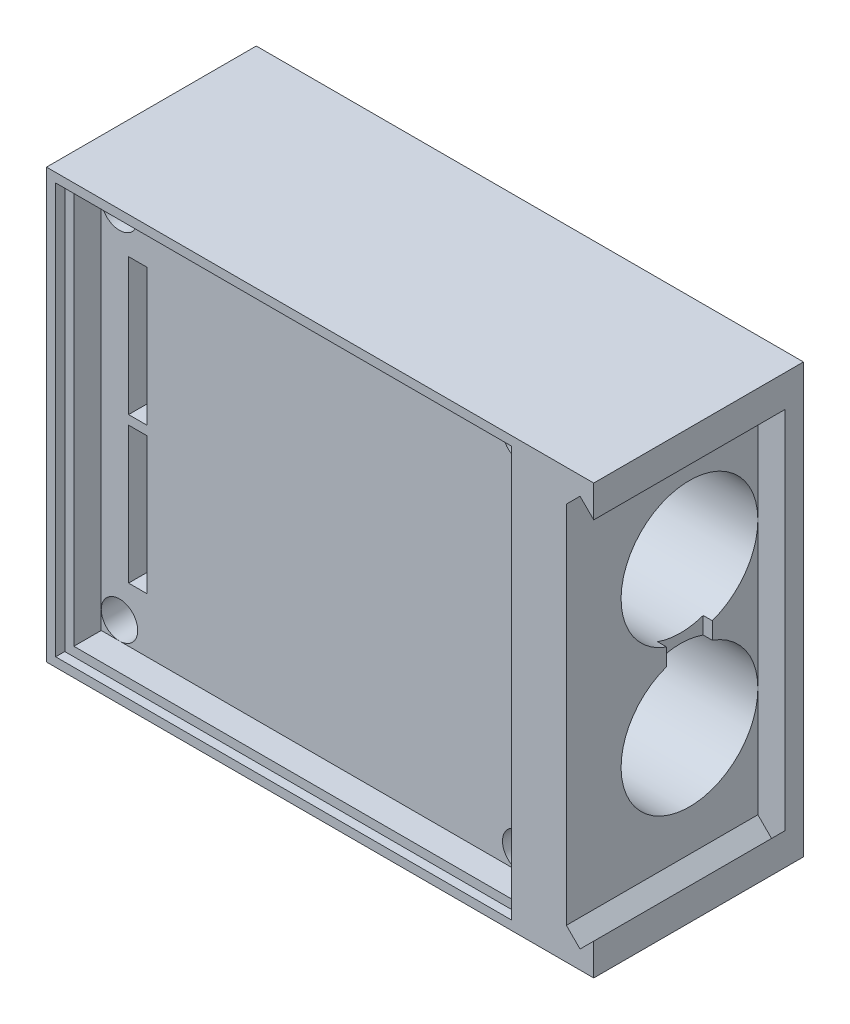
from build123d import *
from OCP.BRepFilletAPI import BRepFilletAPI_MakeChamfer

# Parameters (mm, degrees)
ESQUISSE1_W             = 60
ESQUISSE1_H             = 47
BOSS_EXTRU_1_DEPTH      = 23
ESQUISSE2_W             = 50
ESQUISSE2_H             = 45
ENL_V_MAT_EXTRU_1_DEPTH = 1
ESQUISSE3_W             = 48
ESQUISSE3_H             = 43
ENL_V_MAT_EXTRU_2_DEPTH = 3
ENL_V_MAT_EXTRU_3_DEPTH = 21
ESQUISSE5_R             = 7.5
ENL_V_MAT_EXTRU_4_DEPTH = 51
ESQUISSE8_W             = 2
ESQUISSE8_H             = 15
ENL_V_MAT_EXTRU_5_DEPTH = 17
ESQUISSE9_R             = 2
ENL_V_MAT_EXTRU_6_DEPTH = 80.61155695
CHANFREIN1_SIZE         = 1
CHANFREIN1_SIZE2        = 1.428148007
ESQUISSE10_W            = 5
ESQUISSE10_H            = 10
ENL_V_MAT_EXTRU_7_DEPTH = 1


with BuildPart() as part:
    # Esquisse1 → Boss.-Extru.1 (new body)
    with BuildSketch(Plane.XY):
        with Locations((30, 23.5)):
            Rectangle(ESQUISSE1_W, ESQUISSE1_H)
    extrude(amount=BOSS_EXTRU_1_DEPTH)

    # Esquisse2 → Enlèv. mat.-Extru.1 (cut)
    with BuildSketch(Plane.XY.offset(23)):
        with Locations((26, 23.5)):
            Rectangle(ESQUISSE2_W, ESQUISSE2_H)
    extrude(amount=-ENL_V_MAT_EXTRU_1_DEPTH, mode=Mode.SUBTRACT)

    # Esquisse3 → Enlèv. mat.-Extru.2 (cut)
    with BuildSketch(Plane.XY.offset(22)):
        with Locations((26, 23.5)):
            Rectangle(ESQUISSE3_W, ESQUISSE3_H)
    extrude(amount=-ENL_V_MAT_EXTRU_2_DEPTH, mode=Mode.SUBTRACT)

    # Esquisse4 → Enlèv. mat.-Extru.3 (cut)
    with BuildSketch(Plane.XY.offset(23)):
        Polygon((60, 43.5), (58.5, 45), (57, 43.5), (57, 3.5), (58.5, 2), (60, 3.5), align=None)
    extrude(amount=-ENL_V_MAT_EXTRU_3_DEPTH, mode=Mode.SUBTRACT)

    # Esquisse5 → Enlèv. mat.-Extru.4 (cut)
    with BuildSketch(Plane(origin=(57, 0, 0), x_dir=(0, 0, -1), z_dir=(1, 0, 0))):
        with Locations(Location((-9.5, 31.5, 0), (0, 0, 90))):
            Circle(ESQUISSE5_R)
        with Locations(Location((-9.5, 15.5, 0), (0, 0, 90))):
            Circle(ESQUISSE5_R)
    extrude(amount=-ENL_V_MAT_EXTRU_4_DEPTH, mode=Mode.SUBTRACT)

    # Esquisse8 → Enlèv. mat.-Extru.5 (cut)
    with BuildSketch(Plane.XY.offset(19)):
        with Locations((6, 31.5)):
            Rectangle(ESQUISSE8_W, ESQUISSE8_H)
        with Locations((6, 15.5)):
            Rectangle(ESQUISSE8_W, ESQUISSE8_H)
    extrude(amount=-ENL_V_MAT_EXTRU_5_DEPTH, mode=Mode.SUBTRACT)

    # Esquisse9 → Enlèv. mat.-Extru.6 (cut, through all)
    with BuildSketch(Plane(origin=(0, 0, 0), x_dir=(-1, 0, 0), z_dir=(0, 0, -1))):
        with Locations((-48, 43)):
            Circle(ESQUISSE9_R)
        with Locations((-4, 43)):
            Circle(ESQUISSE9_R)
        with Locations((-4, 4)):
            Circle(ESQUISSE9_R)
        with Locations((-48, 4)):
            Circle(ESQUISSE9_R)
    extrude(amount=-ENL_V_MAT_EXTRU_6_DEPTH, mode=Mode.SUBTRACT)

    # Chanfrein1: one chamfer whose edges measure the first distance from different faces: ONE call of the kernel's chamfer builder (chamfer() names one face for all edges)
    chanfrein1_edges_1 = [part.edges().sort_by_distance(p)[0] for p in [
        (50, 43, 0),
        (6, 43, 0),
        (6, 4, 0),
    ]]
    chanfrein1_side_1 = [part.faces().sort_by_distance(p)[0] for p in [
        (30.072592492, 23.5, 0),
    ]]
    chanfrein1_edges_2 = [part.edges().sort_by_distance(p)[0] for p in [
        (50, 4, 0),
    ]]
    chanfrein1_side_2 = [part.faces().sort_by_distance(p)[0] for p in [
        (50, 4, 9.5),
    ]]
    chanfrein1 = BRepFilletAPI_MakeChamfer(part.part.solid().wrapped)
    for e in chanfrein1_edges_1:
        chanfrein1.Add(CHANFREIN1_SIZE, CHANFREIN1_SIZE2, e.wrapped, chanfrein1_side_1[0].wrapped)  # the first distance lies on this face
    for e in chanfrein1_edges_2:
        chanfrein1.Add(CHANFREIN1_SIZE, CHANFREIN1_SIZE2, e.wrapped, chanfrein1_side_2[0].wrapped)  # the first distance lies on this face
    add(Compound.cast(chanfrein1.Shape()), mode=Mode.REPLACE)

    # Esquisse10 → Enlèv. mat.-Extru.7 (cut)
    with BuildSketch(Plane(origin=(57, 0, 0), x_dir=(0, 0, -1), z_dir=(1, 0, 0))):
        with Locations((-9.5, 22.68303286)):
            Rectangle(ESQUISSE10_W, ESQUISSE10_H)
    extrude(amount=-ENL_V_MAT_EXTRU_7_DEPTH, mode=Mode.SUBTRACT)


solid = part.part
